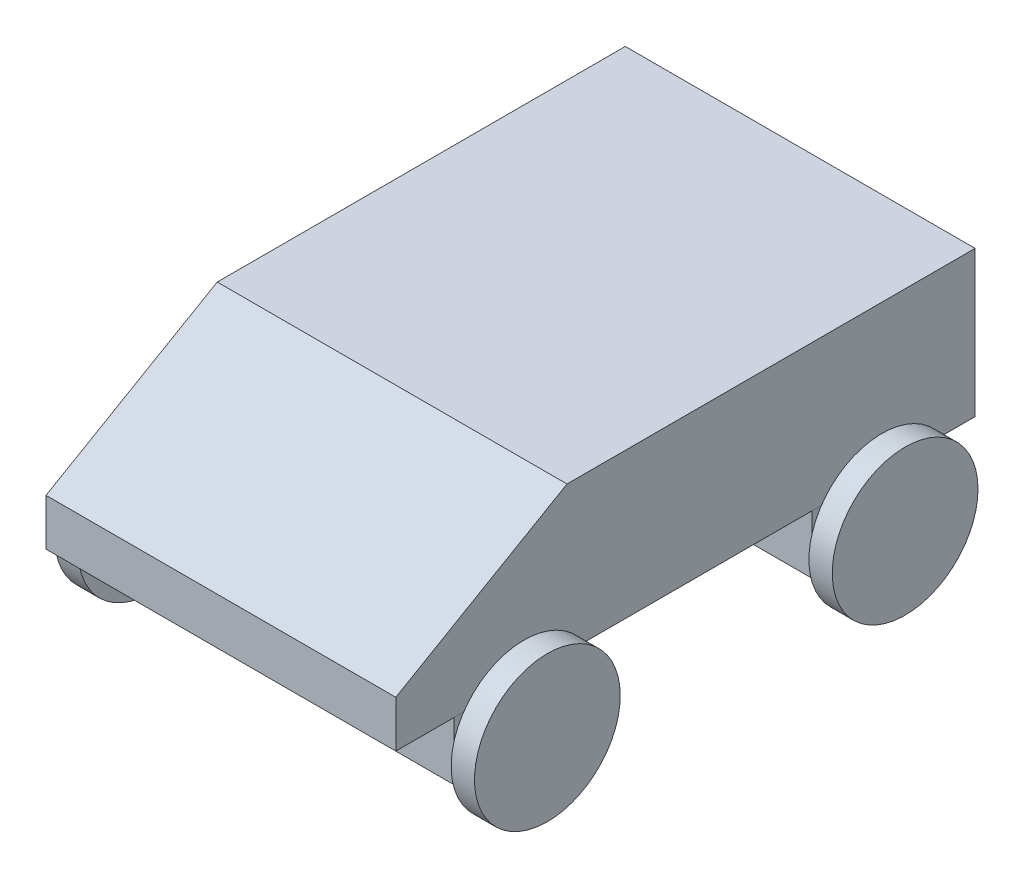
from build123d import *

# Parameters (mm, degrees)
SKETCH1_W             = 76.2
SKETCH1_H             = 31.75
BOSS_EXTRUDE1_DEPTH   = 50
CUT_EXTRUDE1_DEPTH    = 97.511670279
SKETCH3_W             = 76.2
SKETCH3_H             = 31.75
BOSS_EXTRUDE2_DEPTH   = 76.2
SKETCH4_W             = 19.05
SKETCH4_H             = 25.4
BOSS_EXTRUDE3_DEPTH   = 12.7
BOSS_EXTRUDE3_2_DEPTH = 12.7
BOSS_EXTRUDE3_3_DEPTH = 12.7
BOSS_EXTRUDE3_4_DEPTH = 12.7
SKETCH5_R             = 2.54
BOSS_EXTRUDE4_DEPTH   = 2.54
BOSS_EXTRUDE4_2_DEPTH = 2.54
SKETCH6_R             = 15.875
BOSS_EXTRUDE5_DEPTH   = 5.08


with BuildPart() as part:
    # Sketch1 → Boss-Extrude1 (new body)
    with BuildSketch(Plane.XY):
        with Locations((38.1, 15.875)):
            Rectangle(SKETCH1_W, SKETCH1_H)
    extrude(amount=BOSS_EXTRUDE1_DEPTH)

    # Sketch2 → Cut-Extrude1 (cut, through all)
    with BuildSketch(Plane(origin=(76.2, 0, 0), x_dir=(0, 0, -1), z_dir=(1, 0, 0))):
        Polygon((-50, 10.16), (-12.7, 31.75), (-50, 31.75), align=None)
    extrude(amount=-CUT_EXTRUDE1_DEPTH, mode=Mode.SUBTRACT)

    # Sketch3 → Boss-Extrude2 (add)
    with BuildSketch(Plane(origin=(0, 0, 0), x_dir=(-1, 0, 0), z_dir=(0, 0, -1))):
        with Locations((-38.1, 15.875)):
            Rectangle(SKETCH3_W, SKETCH3_H)
    extrude(amount=BOSS_EXTRUDE2_DEPTH)


with BuildPart() as body_2:
    # Sketch4 → Boss-Extrude3 (new body)
    with BuildSketch(Plane.XZ):
        with Locations((66.675, 24.6)):
            Rectangle(SKETCH4_W, SKETCH4_H)
    extrude(amount=BOSS_EXTRUDE3_DEPTH)


with BuildPart() as body_3:
    # Sketch4 → Boss-Extrude3 2 (new body)
    with BuildSketch(Plane.XZ):
        with Locations((66.675, -53.34)):
            Rectangle(SKETCH4_W, SKETCH4_H)
    extrude(amount=BOSS_EXTRUDE3_2_DEPTH)


with BuildPart() as body_4:
    # Sketch4 → Boss-Extrude3 3 (new body)
    with BuildSketch(Plane.XZ):
        with Locations((9.525, 24.6)):
            Rectangle(SKETCH4_W, SKETCH4_H)
    extrude(amount=BOSS_EXTRUDE3_3_DEPTH)


with BuildPart() as body_5:
    # Sketch4 → Boss-Extrude3 4 (new body)
    with BuildSketch(Plane.XZ):
        with Locations((9.525, -53.34)):
            Rectangle(SKETCH4_W, SKETCH4_H)
    extrude(amount=BOSS_EXTRUDE3_4_DEPTH)


with BuildPart() as body_6:
    # Sketch5 → Boss-Extrude4 (new body)
    with BuildSketch(Plane(origin=(76.2, 0, 0), x_dir=(0, 0, -1), z_dir=(1, 0, 0))):
        with Locations((-24.6, -6.35)):
            Circle(SKETCH5_R)
    boss_extrude4 = extrude(amount=BOSS_EXTRUDE4_DEPTH)



with BuildPart() as body_7:
    # Sketch5 → Boss-Extrude4 2 (new body)
    with BuildSketch(Plane(origin=(76.2, 0, 0), x_dir=(0, 0, -1), z_dir=(1, 0, 0))):
        with Locations((53.34, -6.35)):
            Circle(SKETCH5_R)
    boss_extrude4_2 = extrude(amount=BOSS_EXTRUDE4_2_DEPTH)


with BuildPart() as body_6_1:
    add(body_6.part)

    add(body_7.part)  # Boss-Extrude5 merges body 7
    # Sketch6 → Boss-Extrude5 (add)
    with BuildSketch(Plane(origin=(78.74, 0, 0), x_dir=(0, 0, -1), z_dir=(1, 0, 0))):
        with Locations((-24.6, -6.35)):
            Circle(SKETCH6_R)
        with Locations((53.34, -6.35)):
            Circle(SKETCH6_R)
    boss_extrude5 = extrude(amount=BOSS_EXTRUDE5_DEPTH)


with BuildPart() as body_4_1:
    add(body_4.part)

    add(body_5.part)  # Mirror1 merges body 5
    # Mirror1: Boss-Extrude4, Boss-Extrude4 2, Boss-Extrude5 across plane
    add(boss_extrude4.mirror(Plane(origin=(38.1, 0, 0), x_dir=(0, 0, 1), z_dir=(1, 0, 0))))
    add(boss_extrude4_2.mirror(Plane(origin=(38.1, 0, 0), x_dir=(0, 0, 1), z_dir=(1, 0, 0))))
    add(boss_extrude5.mirror(Plane(origin=(38.1, 0, 0), x_dir=(0, 0, 1), z_dir=(1, 0, 0))))


with BuildPart() as body_6_2:
    # Split1: the piece on the far side of the plane
    add(body_4_1.part)
    split(bisect_by=Plane(origin=(0, 0, 0), x_dir=(0, 0, -1), z_dir=(-1, 0, 0)), keep=Keep.BOTTOM)


with BuildPart() as body_4_2:
    add(body_4_1.part)

    # Split1
    split(bisect_by=Plane(origin=(0, 0, 0), x_dir=(0, 0, -1), z_dir=(-1, 0, 0)), keep=Keep.TOP)


solid = Compound([part.part, body_2.part, body_3.part, body_6_1.part, body_6_2.part, body_4_2.part])
